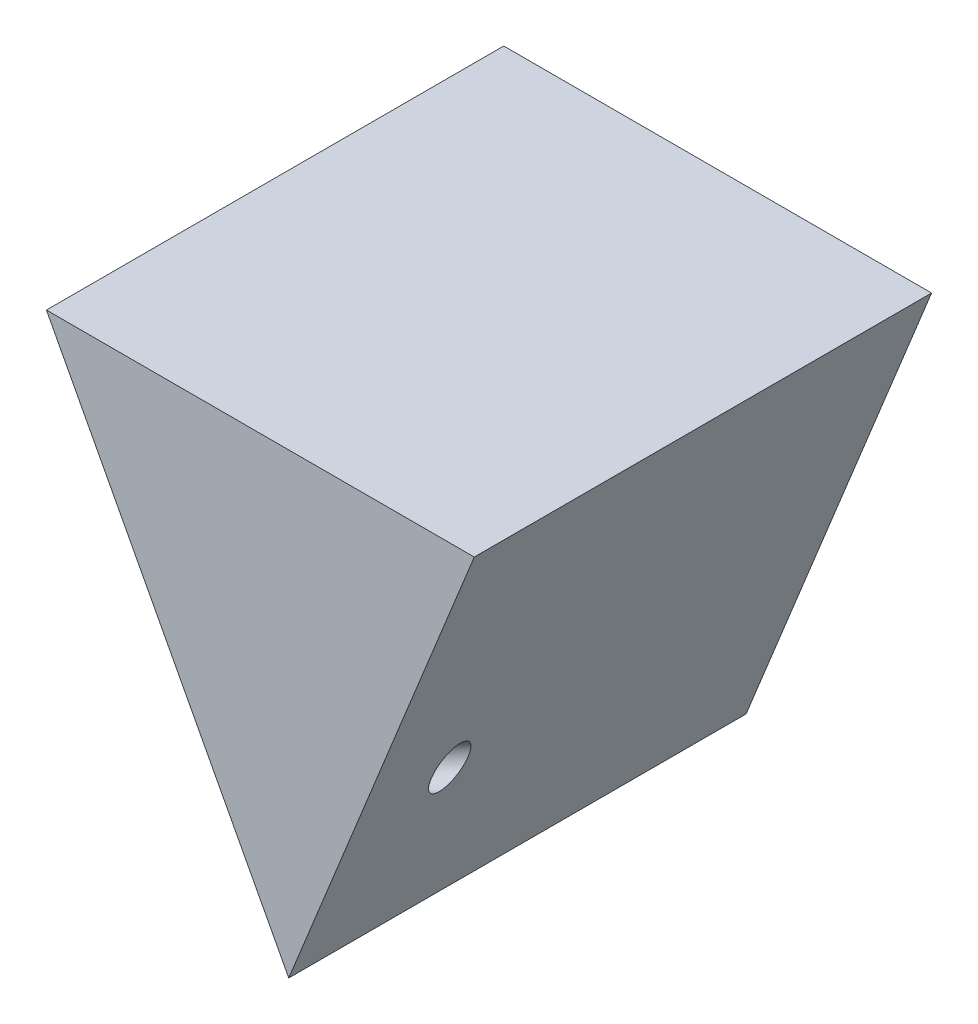
from build123d import *

# Parameters (mm, degrees)
BOSS_EXTRUDE1_DEPTH = 50
SKETCH2_R           = 2
CUT_EXTRUDE1_DEPTH  = 50


with BuildPart() as part:
    # Sketch1 → Boss-Extrude1 (new body)
    with BuildSketch(Plane.XY):
        Polygon((-36.238637744, 19.241346543), (-9.742760301, -30.758653457), (10.539906282, 19.241346543), align=None)
    extrude(amount=BOSS_EXTRUDE1_DEPTH)

    # Sketch2 → Cut-Extrude1 (cut)
    with BuildSketch(Plane(origin=(-20.332646925, -10.77462642, 0), x_dir=(0, 0, 1), z_dir=(-0.8836030430860087, -0.46823675875474063, 0))):
        with Locations(Location((40, -9.616521291, 0), (0, 0, 270))):
            Circle(SKETCH2_R)
    extrude(amount=-CUT_EXTRUDE1_DEPTH, mode=Mode.SUBTRACT)


solid = part.part
